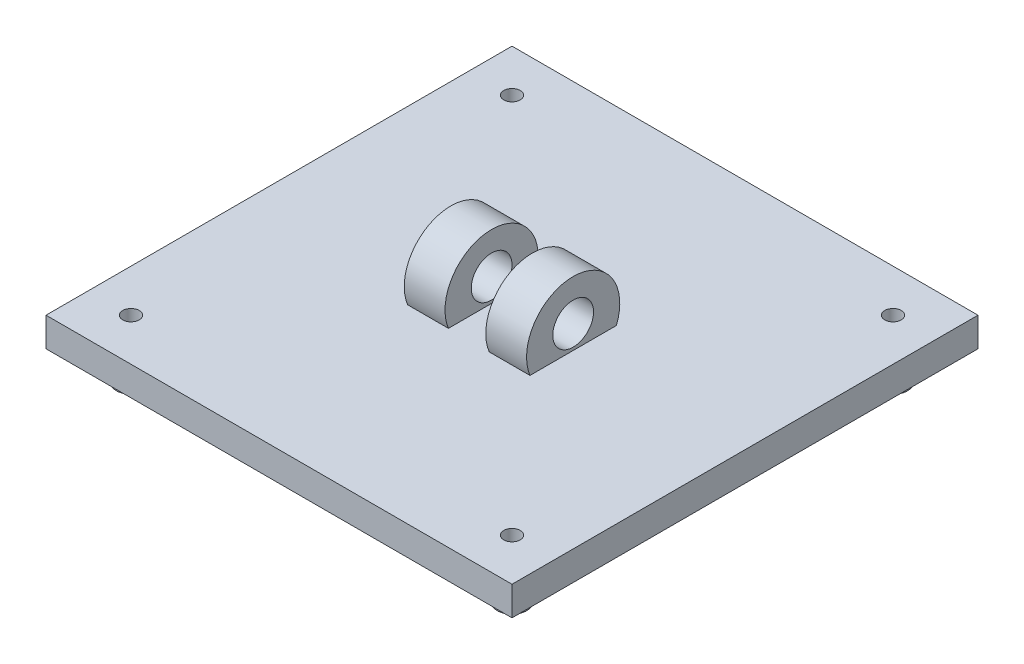
from build123d import *

# Parameters (mm, degrees)
SKETCH2_W           = 80
SKETCH2_H           = 80
BOSS_EXTRUDE1_DEPTH = 5
SKETCH3_R           = 8
BOSS_EXTRUDE2_DEPTH = 10.5
CUT_EXTRUDE3_DEPTH  = 3.5
SKETCH8_R           = 3.5
CUT_EXTRUDE5_DEPTH  = 67.379590237
SKETCH9_R           = 2.5
BOSS_EXTRUDE3_DEPTH = 5
SKETCH10_R          = 1.41
CUT_EXTRUDE6_DEPTH  = 61.340699366


with BuildPart() as part:
    # Sketch2 → Boss-Extrude1 (new body)
    with BuildSketch(Plane(origin=(0, 0, 0), x_dir=(1, 0, 0), z_dir=(0, 1, 0))):
        Rectangle(SKETCH2_W, SKETCH2_H)
    extrude(amount=BOSS_EXTRUDE1_DEPTH)

    # Sketch3 → Boss-Extrude2 (add, symmetric)
    with BuildSketch(Plane(origin=(0, 0, 0), x_dir=(0, 0, -1), z_dir=(1, 0, 0))):
        with Locations((0, 8)):
            Circle(SKETCH3_R)
    extrude(amount=BOSS_EXTRUDE2_DEPTH, both=True)

    # Sketch4 → Cut-Extrude3 (cut, symmetric)
    with BuildSketch(Plane(origin=(0, 0, 0), x_dir=(0, 0, -1), z_dir=(1, 0, 0))):
        Polygon((-114.767025478, 5), (-7.416198487, 5), (7.416198487, 5), (114.767025478, 5), (114.767025478, 219.701653982), (-114.767025478, 219.701653982), align=None)
    extrude(amount=CUT_EXTRUDE3_DEPTH, both=True, mode=Mode.SUBTRACT)

    # Sketch8 → Cut-Extrude5 (cut, through all)
    with BuildSketch(Plane(origin=(10.5, 0, 0), x_dir=(0, 0, -1), z_dir=(1, 0, 0))):
        with Locations((0, 9)):
            Circle(SKETCH8_R)
    extrude(amount=-CUT_EXTRUDE5_DEPTH, mode=Mode.SUBTRACT)

    # Sketch9 → Boss-Extrude3 (add)
    with BuildSketch(Plane.XZ):
        with Locations(Location((-32.705, 32.705, 0), (0, 0, 270))):
            Circle(SKETCH9_R)
        with Locations(Location((32.705, 32.705, 0), (0, 0, 270))):
            Circle(SKETCH9_R)
        with Locations(Location((-32.705, -32.705, 0), (0, 0, 270))):
            Circle(SKETCH9_R)
        with Locations(Location((32.705, -32.705, 0), (0, 0, 270))):
            Circle(SKETCH9_R)
    extrude(amount=BOSS_EXTRUDE3_DEPTH)

    # Sketch10 → Cut-Extrude6 (cut, through all)
    with BuildSketch(Plane.XZ.offset(5)):
        with Locations(Location((-32.705, -32.705, 0), (0, 0, 270))):
            Circle(SKETCH10_R)
        with Locations(Location((-32.705, 32.705, 0), (0, 0, 270))):
            Circle(SKETCH10_R)
        with Locations(Location((32.705, 32.705, 0), (0, 0, 270))):
            Circle(SKETCH10_R)
        with Locations(Location((32.705, -32.705, 0), (0, 0, 270))):
            Circle(SKETCH10_R)
    extrude(amount=-CUT_EXTRUDE6_DEPTH, mode=Mode.SUBTRACT)


solid = part.part
